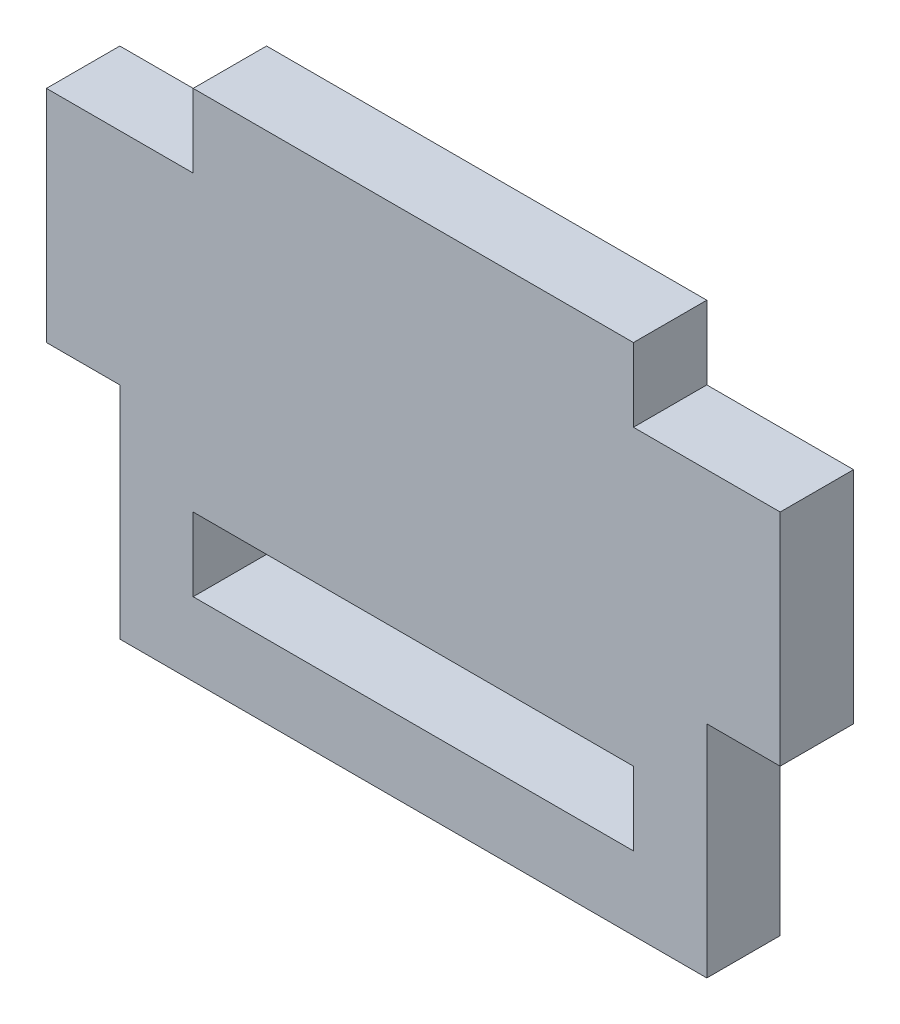
from build123d import *

# Parameters (mm, degrees)
SKETCH1_W           = 30
SKETCH1_H           = 5
SKETCH1_W_2         = 50
SKETCH1_H_2         = 15
SKETCH1_W_3         = 40
BOSS_EXTRUDE1_DEPTH = 5


with BuildPart() as part:
    # Sketch1 → Boss-Extrude1 (new body)
    # profile 1 of 3: a face of its own
    with BuildSketch(Plane.XY):
        with Locations((25, 2.5)):
            Rectangle(SKETCH1_W, SKETCH1_H)
    # profile 2 of 3: a face of its own
    with BuildSketch(Plane.XY):
        with Locations((25, -7.5)):
            Rectangle(SKETCH1_W_2, SKETCH1_H_2)
    # profile 3 of 3: a face of its own
    with BuildSketch(Plane.XY):
        with Locations((25, -22.5)):
            Rectangle(SKETCH1_W_3, SKETCH1_H_2)
        with Locations((25, -22.5)):
            Rectangle(SKETCH1_W, SKETCH1_H, mode=Mode.SUBTRACT)
    extrude(amount=BOSS_EXTRUDE1_DEPTH)


solid = part.part
